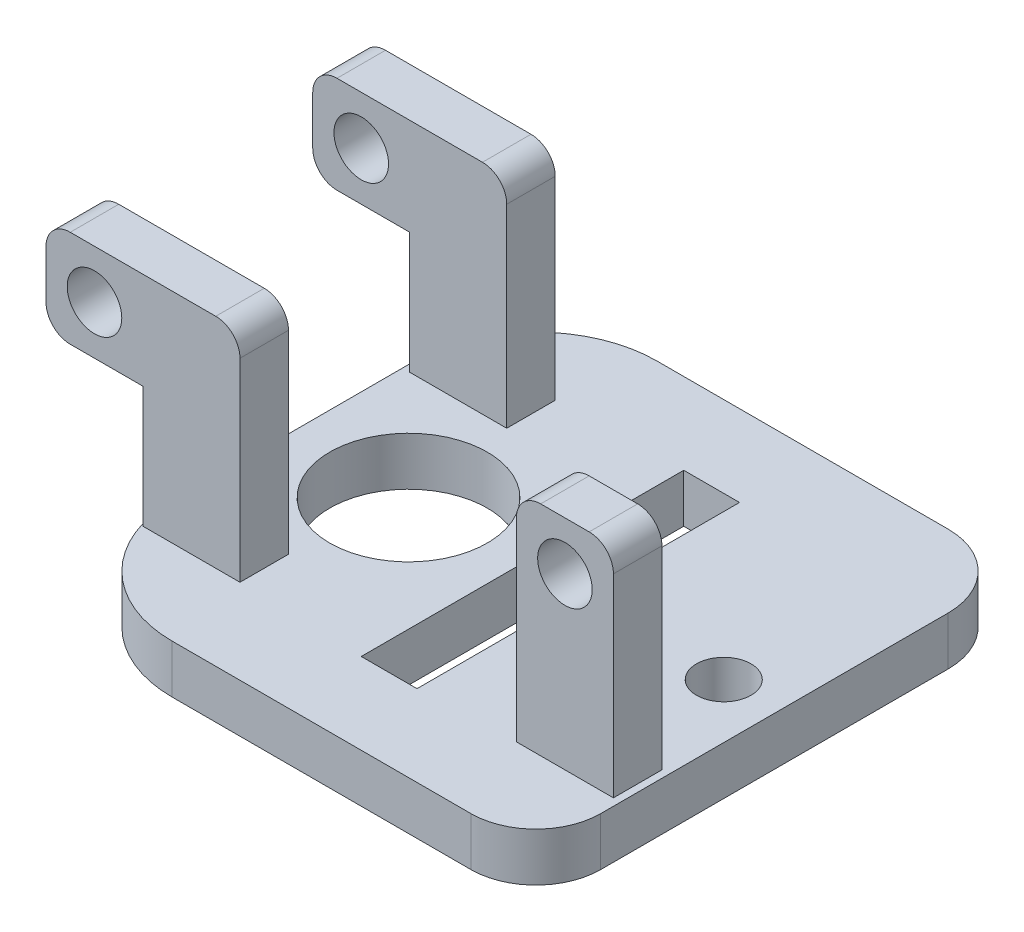
from build123d import *

# Parameters (mm, degrees)
CROQUIS1_R              = 1.125
CROQUIS1_R_2            = 3.25
CROQUIS1_W              = 2.3
CROQUIS1_H              = 13.3
SALIENTE_EXTRUIR1_DEPTH = 2
CROQUIS2_W              = 4
CROQUIS2_H              = 2
SALIENTE_EXTRUIR2_DEPTH = 9
CROQUIS3_R              = 1.125
CORTAR_EXTRUIR1_DEPTH   = 13
CROQUIS5_W              = 2
CROQUIS5_H              = 4
SALIENTE_EXTRUIR3_DEPTH = 4
CROQUIS6_R              = 1.125
CORTAR_EXTRUIR3_DEPTH   = 25.102696945
REDONDEO2_R             = 1


with BuildPart() as part:
    # Croquis1 → Saliente-Extruir1 (new body)
    with BuildSketch(Plane(origin=(0, 0, 0), x_dir=(1, 0, 0), z_dir=(0, 1, 0))):
        with BuildLine():
            Line((-5, -10), (7.32626704, -10))
            ThreePointArc((7.32626704, -10), (9.216881747, -9.216881747), (10, -7.32626704))
            Line((10, -7.32626704), (10, 7))
            ThreePointArc((10, 7), (9.121320344, 9.121320344), (7, 10))
            Line((7, 10), (-5, 10))
            ThreePointArc((-5, 10), (-8.535533906, 8.535533906), (-10, 5))
            Line((-10, 5), (-10, -5))
            ThreePointArc((-10, -5), (-8.535533906, -8.535533906), (-5, -10))
        make_face()
        with Locations(Location((7.75, 0, 0), (0, 0, 270))):
            Circle(CROQUIS1_R, mode=Mode.SUBTRACT)
        with Locations(Location((-5.25, 0, 0), (0, 0, 270))):
            Circle(CROQUIS1_R_2, mode=Mode.SUBTRACT)
        with Locations((0.6, 0)):
            Rectangle(CROQUIS1_W, CROQUIS1_H, mode=Mode.SUBTRACT)
    extrude(amount=SALIENTE_EXTRUIR1_DEPTH)

    # Croquis2 → Saliente-Extruir2 (add)
    with BuildSketch(Plane(origin=(0, 2, 0), x_dir=(1, 0, 0), z_dir=(0, 1, 0))):
        with Locations((-7.7, 5.5)):
            Rectangle(CROQUIS2_W, CROQUIS2_H)
        with Locations((-7.7, -5.5)):
            Rectangle(CROQUIS2_W, CROQUIS2_H)
        with Locations((7.7, -5.5)):
            Rectangle(CROQUIS2_W, CROQUIS2_H)
    extrude(amount=SALIENTE_EXTRUIR2_DEPTH)

    # Croquis3 → Cortar-Extruir1 (cut)
    with BuildSketch(Plane.XY.offset(6.5)):
        with Locations((7.7, 9)):
            Circle(CROQUIS3_R)
    extrude(amount=-CORTAR_EXTRUIR1_DEPTH, mode=Mode.SUBTRACT)

    # Croquis5 → Saliente-Extruir3 (add)
    with BuildSketch(Plane.ZY.offset(9.7)):
        with Locations((5.5, 9)):
            Rectangle(CROQUIS5_W, CROQUIS5_H)
        with Locations((-5.5, 9)):
            Rectangle(CROQUIS5_W, CROQUIS5_H)
    extrude(amount=SALIENTE_EXTRUIR3_DEPTH)

    # Croquis6 → Cortar-Extruir3 (cut, through all)
    with BuildSketch(Plane.XY.offset(6.5)):
        with Locations((-11.7, 9)):
            Circle(CROQUIS6_R)
    extrude(amount=-CORTAR_EXTRUIR3_DEPTH, mode=Mode.SUBTRACT)

    # Redondeo2
    redondeo2_edges = [part.edges().sort_by_distance(p)[0] for p in [
        (-13.7, 11, -5.5),
        (-13.7, 7, -5.5),
        (-5.7, 11, -5.5),
        (-5.7, 11, 5.5),
        (5.7, 11, 5.5),
        (9.7, 11, 5.5),
        (-13.7, 7, 5.5),
        (-13.7, 11, 5.5),
    ]]
    fillet(redondeo2_edges, radius=REDONDEO2_R)


solid = part.part
